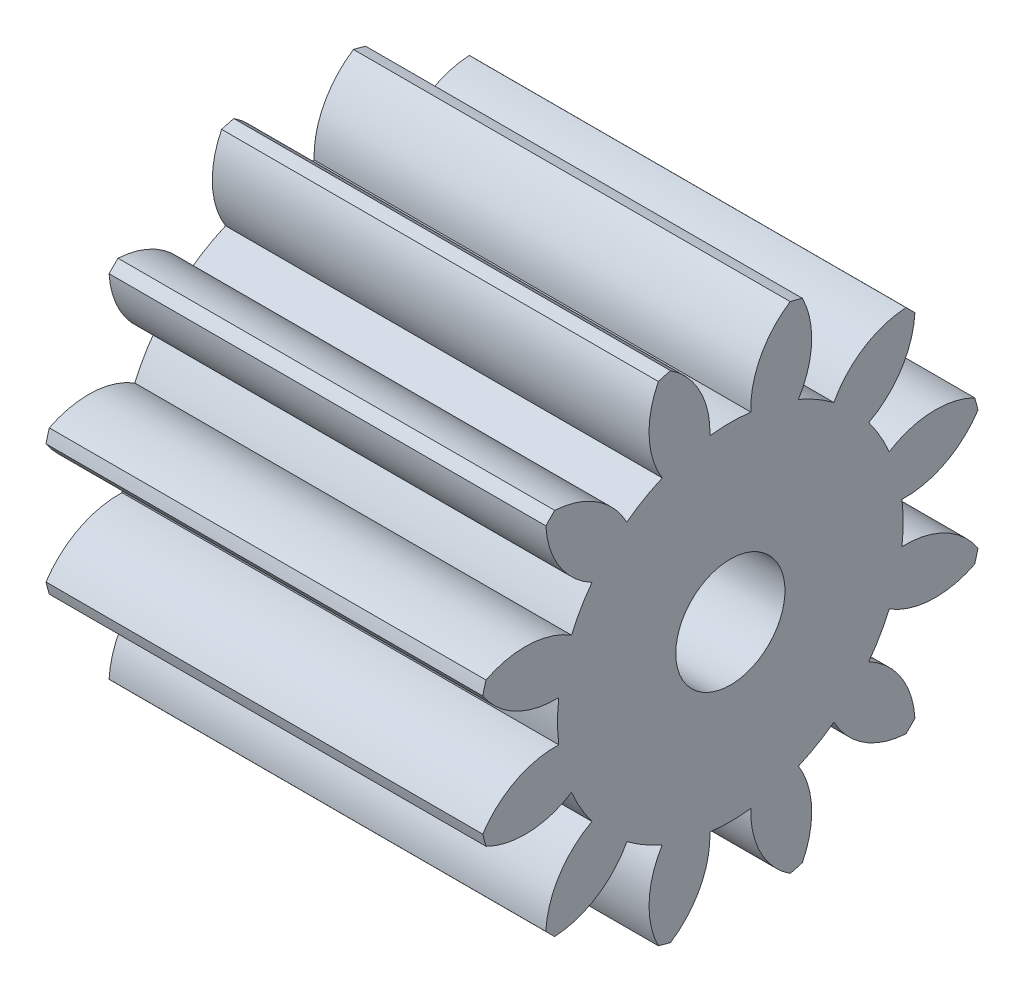
from build123d import *

# Parameters (mm, degrees)
BASPROSKE_W     = 12
BASPROSKE_H     = 7
TOOTHCUT_DEPTH  = 16.556349186
TEETHCUTS_COUNT = 12
TEETHCUTS_ANGLE = 330
BORSKE_R        = 1.5
BORE_DEPTH      = 50.0000508


with BuildPart() as part:
    # BasProSke → Base-Revolve (revolve)
    with BuildSketch(Plane(origin=(0, 0, 0), x_dir=(1, 0, 0), z_dir=(0, 1, 0)), mode=Mode.PRIVATE) as base_revolve_sk:
        with Locations((6, 3.5)):
            Rectangle(BASPROSKE_W, BASPROSKE_H)
    revolve(base_revolve_sk.sketch.rotate(Axis((-10, 0, 0), (1, 0, 0)), 180), axis=Axis((-10, 0, 0), (1, 0, 0)))

    # TooCutSke → ToothCut (cut, through all)
    with BuildSketch(Plane(origin=(0, 0, 0), x_dir=(0, 0, -1), z_dir=(1, 0, 0))):
        with BuildLine():
            ThreePointArc((0.562207301, 4.715604304), (0, 4.749), (-0.562207301, 4.715604304))
            ThreePointArc((-0.562207301, 4.715604304), (-0.837528627, 5.917009812), (-1.672850686, 6.823328788))
            ThreePointArc((-1.672850686, 6.823328788), (0, 7.0254), (1.672850686, 6.823328788))
            ThreePointArc((1.672850686, 6.823328788), (0.837528627, 5.917009812), (0.562207301, 4.715604304))
        make_face()
    toothcut = extrude(amount=TOOTHCUT_DEPTH, mode=Mode.SUBTRACT)

    # TeethCuts: ToothCut ×12 about axis
    teethcuts_axis = Axis((-10, 0, 0), (1, 0, 0))
    for i in range(1, TEETHCUTS_COUNT):
        add(toothcut.rotate(teethcuts_axis, i * TEETHCUTS_ANGLE / (TEETHCUTS_COUNT - 1)), mode=Mode.SUBTRACT)

    # BorSke → Bore (cut, symmetric)
    with BuildSketch(Plane(origin=(0, 0, 0), x_dir=(0, 0, -1), z_dir=(1, 0, 0))):
        with Locations(Location((0, 0, 0), (0, 0, 180))):
            Circle(BORSKE_R)
    extrude(amount=BORE_DEPTH, both=True, mode=Mode.SUBTRACT)


solid = part.part
